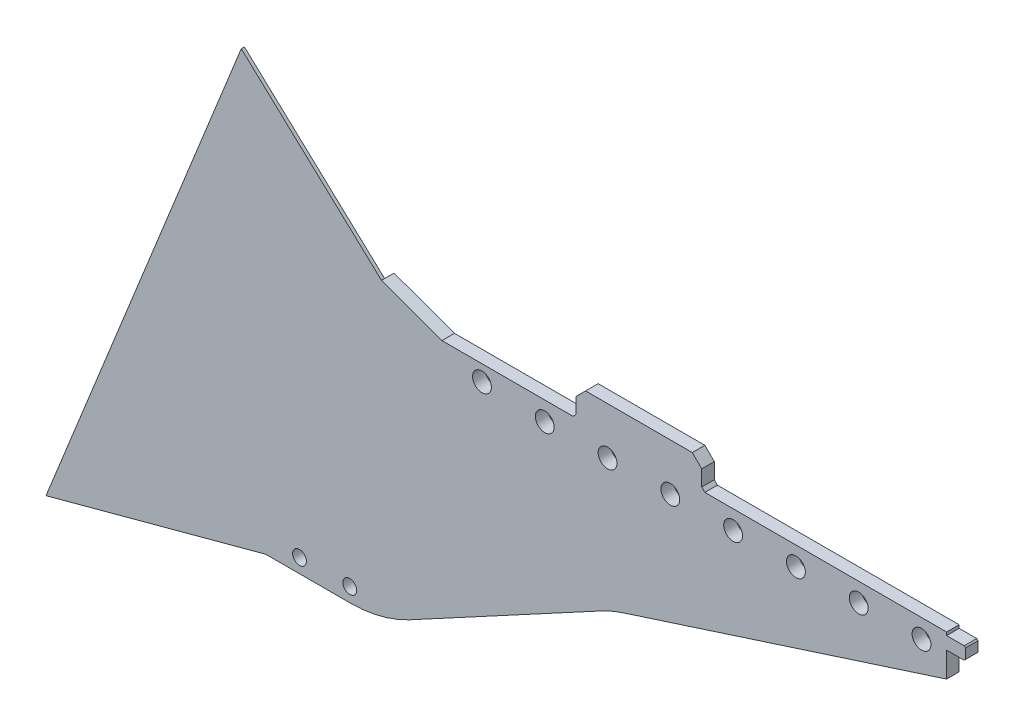
from build123d import *

# Parameters (mm, degrees)
SKETCH_1_R      = 1.1
SKETCH_1_R_2    = 1.5
EXTRUDE_1_DEPTH = 2
EXTRUDE_START   = -0.5
EXTRUDE_2_DEPTH = 0.5


with BuildPart() as part:
    # 草图1 → 凸台-拉伸1 (new body)
    with BuildSketch(Plane.XY):
        with BuildLine():
            Line((56.016004386, 19), (53.216004386, 19))
            Line((53.216004386, 19), (53.216004386, 19.5))
            Line((53.216004386, 19.5), (14.716004386, 19.5))
            Line((14.716004386, 19.5), (14.216004386, 20))
            Line((14.216004386, 20), (14.216004386, 22.5))
            Line((14.216004386, 22.5), (12.716004386, 24))
            Line((12.716004386, 24), (-4.283995614, 24))
            Line((-4.283995614, 24), (-5.783995614, 22.5))
            Line((-5.783995614, 22.5), (-5.783995614, 20))
            Line((-5.783995614, 20), (-6.283995614, 19.5))
            Line((-6.283995614, 19.5), (-27.158995614, 19.5))
            Line((-27.158995614, 19.5), (-36.783995614, 23))
            Line((-36.783995614, 23), (-36.783995614, 19))
            Line((-36.783995614, 19), (-56.122725498, -22.57826925))
            ThreePointArc((-56.122725498, -22.57826925), (-56.059132712, -23.5377124), (-55.216004386, -24))
            Line((-55.216004386, -24), (-41.838790186, -24))
            ThreePointArc((-41.838790186, -24), (-36.938094618, -23.390285788), (-32.336201424, -21.598318295))
            Line((-32.336201424, -21.598318295), (-1.744334209, -5.079584588))
            ThreePointArc((-1.744334209, -5.079584588), (-0.095831441, -4.284607006), (1.618440476, -3.643652619))
            Line((1.618440476, -3.643652619), (53.216004386, 13))
            Line((53.216004386, 13), (53.216004386, 17))
            Line((53.216004386, 17), (56.016004386, 17))
            Line((56.016004386, 17), (56.216004386, 17.2))
            Line((56.216004386, 17.2), (56.216004386, 18.8))
            Line((56.216004386, 18.8), (56.016004386, 19))
        make_face()
        with Locations((-41.838790186, -21.75)):
            Circle(SKETCH_1_R, mode=Mode.SUBTRACT)
        with Locations((-49.838790186, -21.75)):
            Circle(SKETCH_1_R, mode=Mode.SUBTRACT)
        with Locations((49.216004386, 16.5)):
            Circle(SKETCH_1_R_2, mode=Mode.SUBTRACT)
        with Locations((39.216004386, 16.5)):
            Circle(SKETCH_1_R_2, mode=Mode.SUBTRACT)
        with Locations((29.216004386, 16.5)):
            Circle(SKETCH_1_R_2, mode=Mode.SUBTRACT)
        with Locations((19.216004386, 16.5)):
            Circle(SKETCH_1_R_2, mode=Mode.SUBTRACT)
        with Locations((9.216004386, 16.5)):
            Circle(SKETCH_1_R_2, mode=Mode.SUBTRACT)
        with Locations((-0.783995614, 16.5)):
            Circle(SKETCH_1_R_2, mode=Mode.SUBTRACT)
        with Locations((-10.783995614, 16.5)):
            Circle(SKETCH_1_R_2, mode=Mode.SUBTRACT)
        with Locations((-20.783995614, 17)):
            Circle(SKETCH_1_R_2, mode=Mode.SUBTRACT)
    extrude(amount=EXTRUDE_1_DEPTH)

    # 草图2 → 凸台-拉伸2 (add)
    with BuildSketch(Plane.XY.offset(2).offset(EXTRUDE_START)):
        with BuildLine():
            Line((-55.216004386, -24), (-90.216004386, -33.41495792))
            Line((-90.216004386, -33.41495792), (-59.114143441, 43.782364027))
            Line((-59.114143441, 43.782364027), (-36.783995614, 23))
            Line((-36.783995614, 23), (-36.783995614, 19))
            Line((-36.783995614, 19), (-56.122725498, -22.57826925))
            ThreePointArc((-56.122725498, -22.57826925), (-56.059132712, -23.5377124), (-55.216004386, -24))
        make_face()
    extrude(amount=EXTRUDE_2_DEPTH)


solid = part.part
